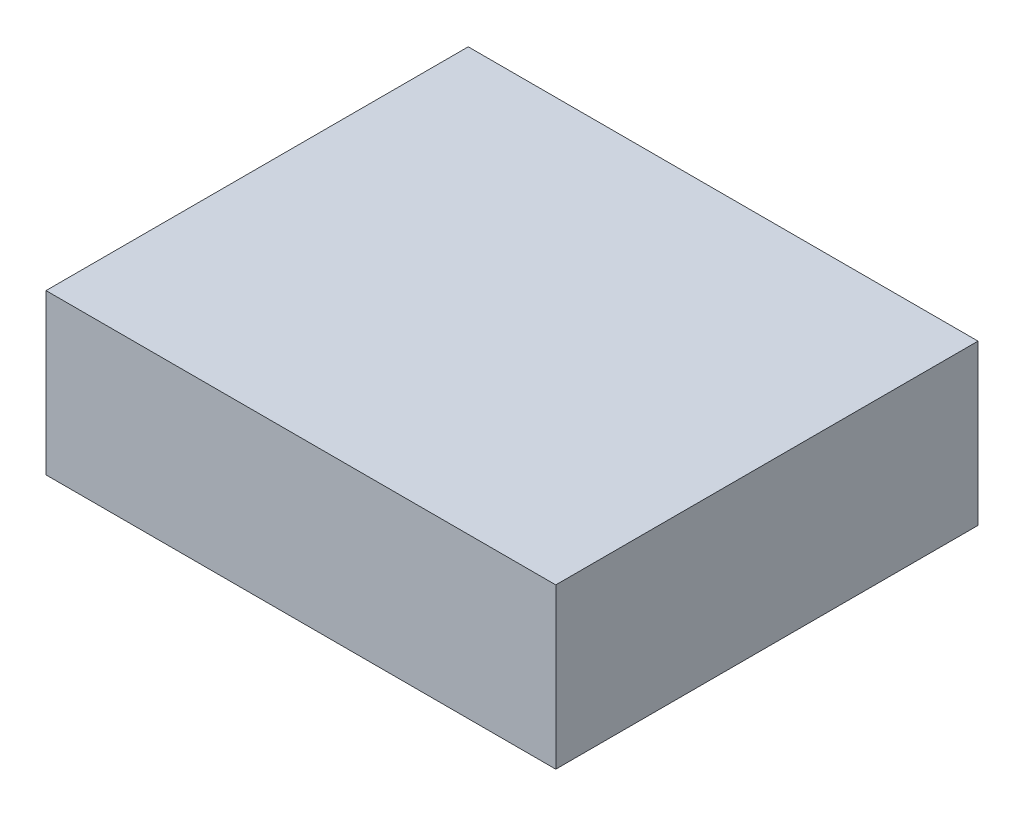
from build123d import *

# Parameters (mm, degrees)
SKETCH1_W           = 99
SKETCH1_H           = 82
BOSS_EXTRUDE1_DEPTH = 31


with BuildPart() as part:
    # Sketch1 → Boss-Extrude1 (new body)
    with BuildSketch(Plane(origin=(0, 0, 0), x_dir=(1, 0, 0), z_dir=(0, 1, 0))):
        Rectangle(SKETCH1_W, SKETCH1_H)
    extrude(amount=BOSS_EXTRUDE1_DEPTH)


solid = part.part
